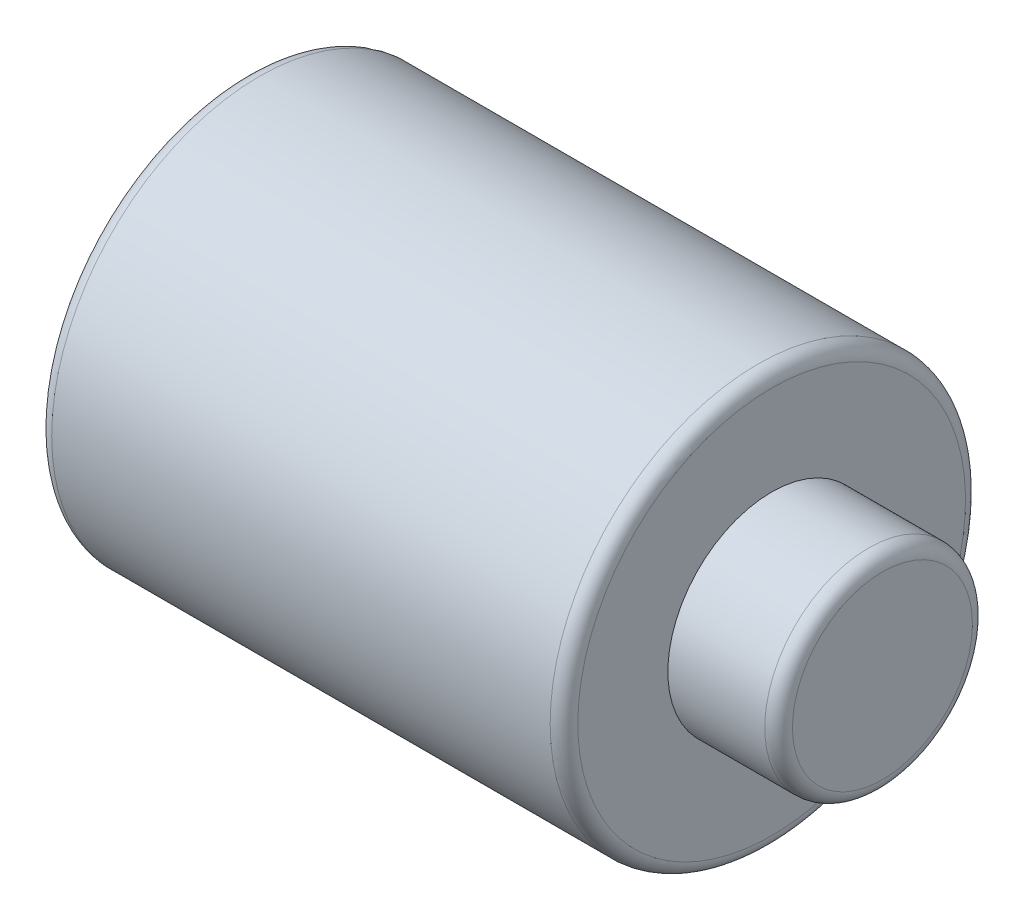
from build123d import *

# Parameters (mm, degrees)
IZIM2_R               = 4.25
KES_EKSTR_ZYON1_DEPTH = 30
RADYUS1_R             = 1


with BuildPart() as part:
    # Çizim1 → Döndür1 (revolve)
    with BuildSketch(Plane.XY):
        Polygon((0, 0), (0, 15), (38, 15), (38, 7.5), (46, 7.5), (46, 0), align=None)
    revolve(axis=Axis((46, 0, 0), (-1, 0, 0)))

    # Çizim2 → Kes-Ekstrüzyon1 (cut)
    with BuildSketch(Plane.ZY):
        with Locations(Location((0, 0, 0), (0, 0, 270))):
            Circle(IZIM2_R)
    extrude(amount=-KES_EKSTR_ZYON1_DEPTH, mode=Mode.SUBTRACT)

    # Radyus1
    radyus1_edges = [part.edges().sort_by_distance(p)[0] for p in [
        (46, -7.5, 0),
        (38, -15, 0),
        (0, -15, 0),
    ]]
    fillet(radyus1_edges, radius=RADYUS1_R)


solid = part.part
